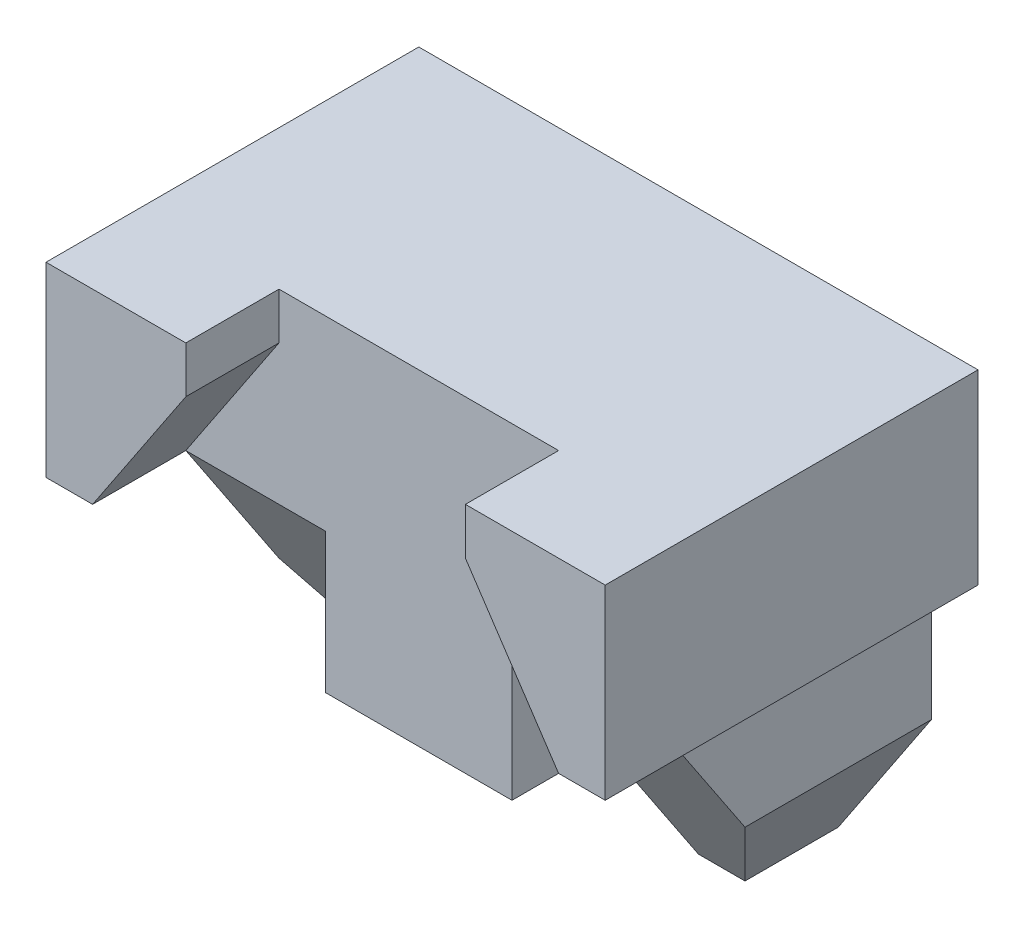
from build123d import *

# Parameters (mm, degrees)
BOSS_EXTRUDE1_DEPTH = 60
BOSS_EXTRUDE2_DEPTH = 20
CUT_EXTRUDE1_DEPTH  = 30
CUT_EXTRUDE2_DEPTH  = 30


with BuildPart() as part:
    # Sketch1 → Boss-Extrude1 (new body)
    with BuildSketch(Plane.XY):
        Polygon((0, 0), (10, 0), (10, 30), (50, 30), (50, 0), (60, 0), (80, 30), (80, 60), (90, 60), (90, 100), (-30, 100), (-30, 60), (-20, 60), (-20, 30), align=None)
    extrude(amount=BOSS_EXTRUDE1_DEPTH)

    # Sketch2 → Boss-Extrude2 (add)
    with BuildSketch(Plane.XY.offset(60)):
        Polygon((-20, 60), (0, 90), (0, 100), (-30, 100), (-30, 60), align=None)
        Polygon((80, 60), (60, 90), (60, 100), (90, 100), (90, 60), align=None)
    extrude(amount=BOSS_EXTRUDE2_DEPTH)

    # Sketch3 → Cut-Extrude1 (cut)
    with BuildSketch(Plane.ZY.offset(20)):
        Polygon((60, 60), (20, 0), (60, 0), align=None)
    extrude(amount=-CUT_EXTRUDE1_DEPTH, mode=Mode.SUBTRACT)

    # Sketch4 → Cut-Extrude2 (cut)
    with BuildSketch(Plane(origin=(80, 0, 0), x_dir=(0, 0, -1), z_dir=(1, 0, 0))):
        Polygon((-60, 60), (-20, 0), (-60, 0), align=None)
    extrude(amount=-CUT_EXTRUDE2_DEPTH, mode=Mode.SUBTRACT)


solid = part.part
